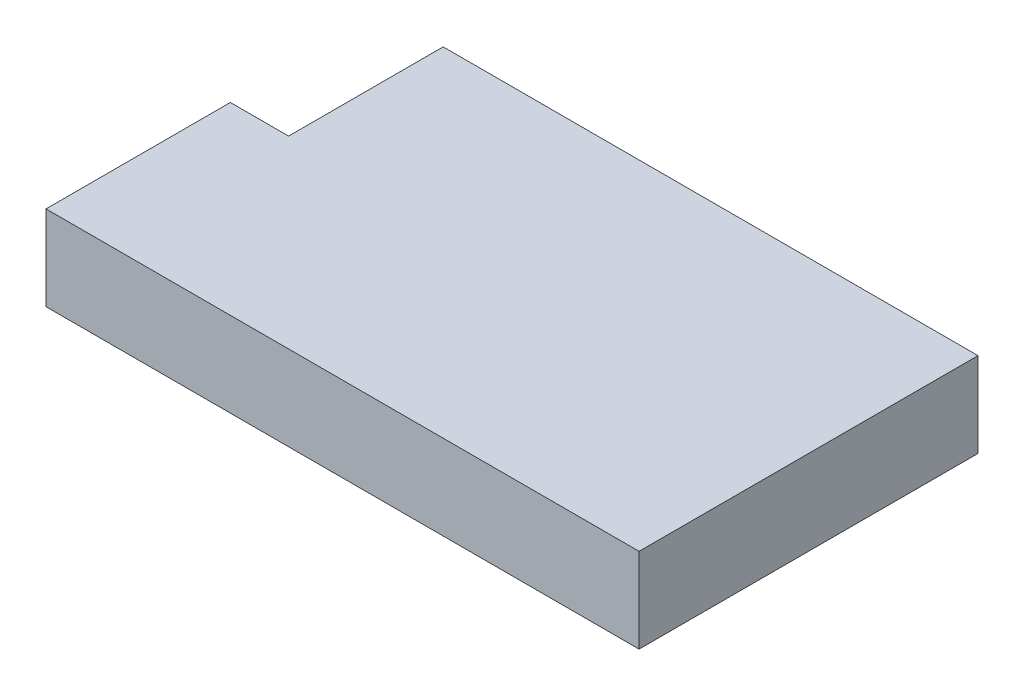
from build123d import *

# Parameters (mm, degrees)
SKETCH1_W           = 210
SKETCH1_H           = 120
BOSS_EXTRUDE1_DEPTH = 30
CUT_EXTRUDE1_REACH  = 126.599
SKETCH2_W           = 20.632503002
SKETCH2_H           = 54.730004003


with BuildPart() as part:
    # Sketch1 → Boss-Extrude1 (new body)
    with BuildSketch(Plane(origin=(0, 0, 0), x_dir=(1, 0, 0), z_dir=(0, 1, 0))):
        Rectangle(SKETCH1_W, SKETCH1_H)
    extrude(amount=-BOSS_EXTRUDE1_DEPTH)

    # Sketch2 → Cut-Extrude1 (cut, up to next)
    with BuildSketch(Plane(origin=(0, 0, 0), x_dir=(1, 0, 0), z_dir=(0, 1, 0)), mode=Mode.PRIVATE) as cut_extrude1_sk1:
        with Locations((-94.683748499, 32.634997999)):
            Rectangle(SKETCH2_W, SKETCH2_H)
    cut_extrude1_tool1 = extrude(cut_extrude1_sk1.sketch, amount=-CUT_EXTRUDE1_REACH, mode=Mode.PRIVATE) & part.part
    add(cut_extrude1_tool1.solids().sort_by_distance((-94.683748, 0, -32.634998))[0], mode=Mode.SUBTRACT)


solid = part.part
